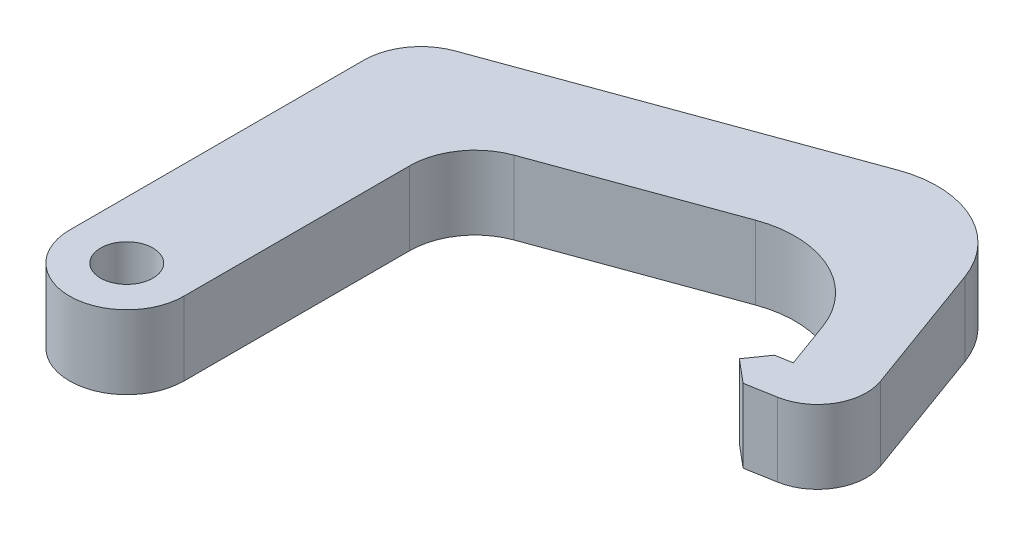
from build123d import *

# Parameters (mm, degrees)
SKETCH1_R           = 1.6
BOSS_EXTRUDE1_DEPTH = 4.5
FILLET1_R           = 4
FILLET2_R           = 6
FILLET3_R           = 3
CHAMFER1_SIZE       = 2
CHAMFER1_SIZE2      = 1.419615628


with BuildPart() as part:
    # Sketch1 → Boss-Extrude1 (new body)
    # profile 1 of 2: a face of its own
    with BuildSketch(Plane(origin=(0, 0, 0), x_dir=(1, 0, 0), z_dir=(0, 1, 0))):
        with BuildLine():
            Line((3.5, 0), (3.5, 18))
            ThreePointArc((3.5, 18), (0, 21.5), (-3.5, 18))
            Line((-3.5, 18), (-3.5, 0))
            ThreePointArc((-3.5, 0), (0, -3.5), (3.5, 0))
        make_face()
        with Locations(Location((0, 0, 0), (0, 0, 270))):
            Circle(SKETCH1_R, mode=Mode.SUBTRACT)
    # profile 2 of 2: a face of its own
    with BuildSketch(Plane(origin=(0, 0, 0), x_dir=(1, 0, 0), z_dir=(0, 1, 0))):
        with BuildLine():
            Line((24.303924048, 30.570527133), (-1.197070502, 21.288924173))
            ThreePointArc((-1.197070502, 21.288924173), (2.007517527, 20.867032155), (3.5, 18))
            Line((3.5, 18), (3.5, 16.613451389))
            Line((3.5, 16.613451389), (22.597274425, 23.564290835))
            Line((22.597274425, 23.564290835), (25.675455715, 15.107057248))
            Line((25.675455715, 15.107057248), (22.721032456, 14.586112715))
            Line((22.721032456, 14.586112715), (25.221032456, 12.488363637))
            Line((25.221032456, 12.488363637), (30.543696603, 13.426892935))
            Line((30.543696603, 13.426892935), (24.303924048, 30.570527133))
        make_face()
    extrude(amount=BOSS_EXTRUDE1_DEPTH)

    # Fillet1
    fillet1_edges = [part.edges().sort_by_distance(p)[0] for p in [
        (3.5, 2.25, -16.613451389),
    ]]
    fillet(fillet1_edges, radius=FILLET1_R)

    # Fillet2
    fillet2_edges = [part.edges().sort_by_distance(p)[0] for p in [
        (24.303924048, 2.25, -30.570527133),
        (22.597274425, 2.25, -23.564290835),
    ]]
    fillet(fillet2_edges, radius=FILLET2_R)

    # Fillet3
    fillet3_edges = [part.edges().sort_by_distance(p)[0] for p in [
        (30.543696603, 2.25, -13.426892935),
    ]]
    fillet(fillet3_edges, radius=FILLET3_R)

    # Chamfer1
    chamfer1_edges = [part.edges().sort_by_distance(p)[0] for p in [
        (22.721032456, 2.25, -14.586112715),
    ]]
    chamfer1_side = [part.faces().sort_by_distance(p)[0] for p in [
        (24.198244085, 2.25, -14.846584982),
    ]]
    chamfer(chamfer1_edges, length=CHAMFER1_SIZE, length2=CHAMFER1_SIZE2, reference=chamfer1_side[0])


solid = part.part
